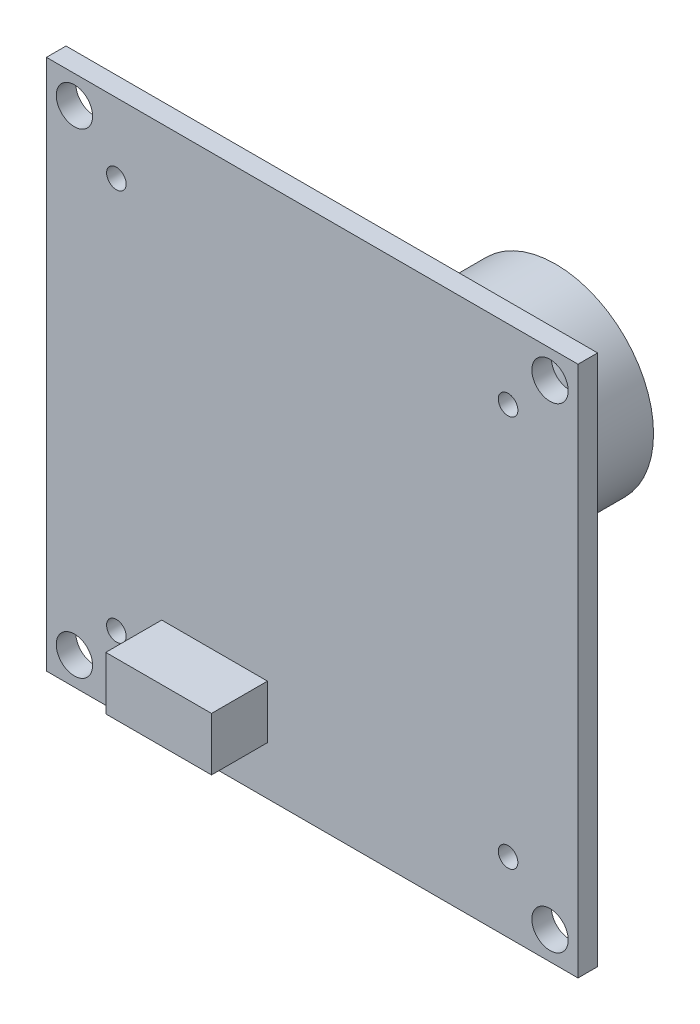
from build123d import *

# Parameters (mm, degrees)
SKETCH1_W           = 38
SKETCH1_H           = 38
SKETCH1_R           = 1.3
SKETCH1_R_2         = 0.7
BOSS_EXTRUDE1_DEPTH = 1.4
SKETCH2_W           = 7.56
SKETCH2_H           = 3.81
BOSS_EXTRUDE2_DEPTH = 4
SKETCH3_R           = 7
BOSS_EXTRUDE3_DEPTH = 16


with BuildPart() as part:
    # Sketch1 → Boss-Extrude1 (new body)
    # profile 1 of 2: a face of its own
    with BuildSketch(Plane.XY):
        with Locations((14, 14)):
            Rectangle(SKETCH1_W, SKETCH1_H)
        with Locations((-3, -3)):
            Circle(SKETCH1_R, mode=Mode.SUBTRACT)
        with Locations((31, -3)):
            Circle(SKETCH1_R, mode=Mode.SUBTRACT)
        with Locations((31, 31)):
            Circle(SKETCH1_R, mode=Mode.SUBTRACT)
        with Locations((-3, 31)):
            Circle(SKETCH1_R, mode=Mode.SUBTRACT)
        with BuildLine():
            ThreePointArc((0.1, 29.3), (-0.889949494, 28.889949494), (-1.3, 27.9))
            Line((-1.3, 27.9), (-1.3, 0.1))
            ThreePointArc((-1.3, 0.1), (-0.889949494, -0.889949494), (0.1, -1.3))
            Line((0.1, -1.3), (27.9, -1.3))
            ThreePointArc((27.9, -1.3), (28.889949494, -0.889949494), (29.3, 0.1))
            Line((29.3, 0.1), (29.3, 27.9))
            ThreePointArc((29.3, 27.9), (28.889949494, 28.889949494), (27.9, 29.3))
            Line((27.9, 29.3), (0.1, 29.3))
        make_face(mode=Mode.SUBTRACT)
    # profile 2 of 2: a face of its own
    with BuildSketch(Plane.XY):
        with BuildLine():
            Line((0.1, 29.3), (27.9, 29.3))
            ThreePointArc((27.9, 29.3), (28.889949494, 28.889949494), (29.3, 27.9))
            Line((29.3, 27.9), (29.3, 0.1))
            ThreePointArc((29.3, 0.1), (28.889949494, -0.889949494), (27.9, -1.3))
            Line((27.9, -1.3), (0.1, -1.3))
            ThreePointArc((0.1, -1.3), (-0.889949494, -0.889949494), (-1.3, 0.1))
            Line((-1.3, 0.1), (-1.3, 27.9))
            ThreePointArc((-1.3, 27.9), (-0.889949494, 28.889949494), (0.1, 29.3))
        make_face()
        with Locations((0, 28)):
            Circle(SKETCH1_R_2, mode=Mode.SUBTRACT)
        with Locations((28, 28)):
            Circle(SKETCH1_R_2, mode=Mode.SUBTRACT)
        Circle(SKETCH1_R_2, mode=Mode.SUBTRACT)
        with Locations((28, 0)):
            Circle(SKETCH1_R_2, mode=Mode.SUBTRACT)
    extrude(amount=BOSS_EXTRUDE1_DEPTH)

    # Sketch2 → Boss-Extrude2 (add)
    with BuildSketch(Plane.XY.offset(1.4)):
        with Locations((7.02, 0.375)):
            Rectangle(SKETCH2_W, SKETCH2_H)
    extrude(amount=BOSS_EXTRUDE2_DEPTH)

    # Sketch3 → Boss-Extrude3 (add)
    with BuildSketch(Plane(origin=(0, 0, 0), x_dir=(-1, 0, 0), z_dir=(0, 0, -1))):
        with Locations(Location((-14, 14, 0), (0, 0, 180))):
            Circle(SKETCH3_R)
    extrude(amount=BOSS_EXTRUDE3_DEPTH)


solid = part.part
